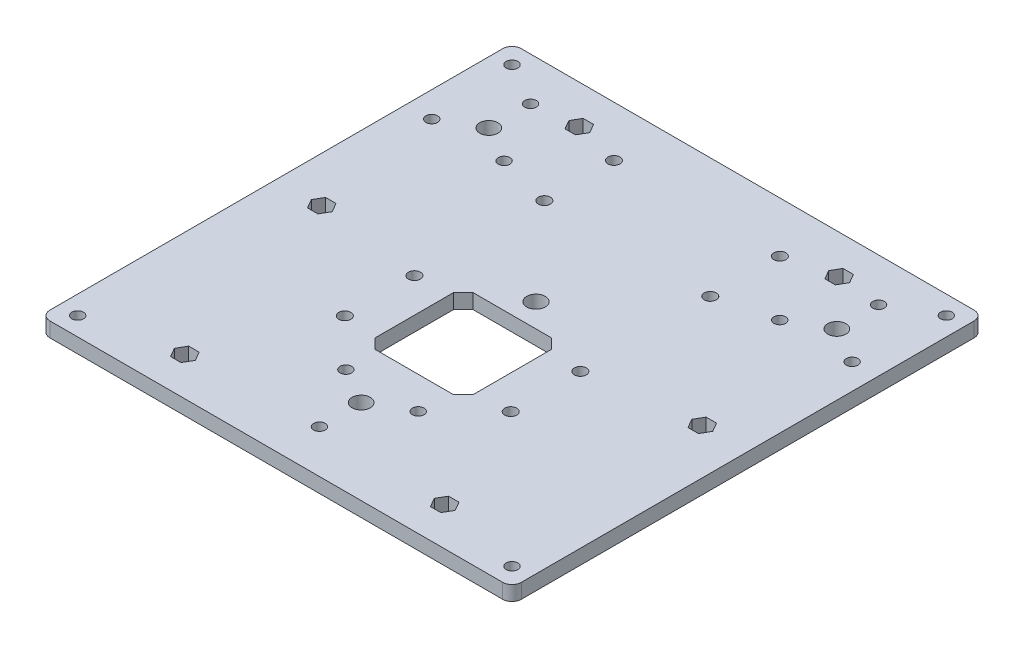
from build123d import *

# Parameters (mm, degrees)
ESQUISSE1_W                = 203.2
ESQUISSE1_H                = 203.2
BOSS_EXTRU_1_DEPTH         = 6.35
ESQUISSE2_R                = 3.925
ENL_V_MAT_EXTRU_1_DEPTH    = 144.824345992
ESQUISSE5_R                = 2.6
ENL_V_MAT_EXTRU_4_DEPTH    = 144.824345992
ESQUISSE6_R                = 2.5
ENL_V_MAT_EXTRU_5_DEPTH    = 144.824345992
ESQUISSE7_R                = 2.5
ENL_V_MAT_EXTRU_6_DEPTH    = 144.824345992
ESQUISSE8_R                = 4
ENL_V_MAT_EXTRU_7_DEPTH    = 144.824345992
ESQUISSE9_R                = 2.5
ENL_V_MAT_EXTRU_8_DEPTH    = 144.824345992
SYM_TRIE2_COPY_1_SKETCH_R  = 2.5
SYM_TRIE2_COPY_1_DEPTH     = 144.824345992
ENL_V_MAT_EXTRU_9_DEPTH    = 144.824345992
CONG_1_R                   = 4
ENL_V_MAT_EXTRU_10_DEPTH   = 144.824345992
R_P_TITION_LIN_AIRE3_COUNT = 2
R_P_TITION_LIN_AIRE3_PITCH = 86


with BuildPart() as part:
    # Esquisse1 → Boss.-Extru.1 (new body)
    with BuildSketch(Plane(origin=(0, 0, 0), x_dir=(1, 0, 0), z_dir=(0, 1, 0))):
        Rectangle(ESQUISSE1_W, ESQUISSE1_H)
    extrude(amount=BOSS_EXTRU_1_DEPTH)

    # Esquisse2 → Enlèv. mat.-Extru.1 (cut, through all)
    with BuildSketch(Plane(origin=(0, 6.35, 0), x_dir=(1, 0, 0), z_dir=(0, 1, 0))):
        with Locations(Location((-75, 65, 0), (0, 0, 270))):
            Circle(ESQUISSE2_R)
        with Locations(Location((75, 65, 0), (0, 0, 270))):
            Circle(ESQUISSE2_R)
        with Locations(Location((0, -65, 0), (0, 0, 270))):
            Circle(ESQUISSE2_R)
    extrude(amount=-ENL_V_MAT_EXTRU_1_DEPTH, mode=Mode.SUBTRACT)

    # Esquisse5 → Enlèv. mat.-Extru.4 (cut, through all)
    with BuildSketch(Plane(origin=(0, 6.35, 0), x_dir=(1, 0, 0), z_dir=(0, 1, 0))):
        with Locations(Location((-35.9, 49.85, 0), (0, 0, 270))):
            Circle(ESQUISSE5_R)
        with Locations(Location((-35.9, 79.85, 0), (0, 0, 270))):
            Circle(ESQUISSE5_R)
        with Locations(Location((35.6, 49.85, 0), (0, 0, 270))):
            Circle(ESQUISSE5_R)
        with Locations(Location((35.6, 79.85, 0), (0, 0, 270))):
            Circle(ESQUISSE5_R)
    enl_v_mat_extru_4 = extrude(amount=-ENL_V_MAT_EXTRU_4_DEPTH, mode=Mode.SUBTRACT)

    # Esquisse6 → Enlèv. mat.-Extru.5 (cut, through all)
    with BuildSketch(Plane(origin=(0, 6.35, 0), x_dir=(1, 0, 0), z_dir=(0, 1, 0))):
        with Locations(Location((93.6, -93.6, 0), (0, 0, 270))):
            Circle(ESQUISSE6_R)
        with Locations(Location((-93.6, -93.6, 0), (0, 0, 270))):
            Circle(ESQUISSE6_R)
        with Locations(Location((-93.6, 93.6, 0), (0, 0, 270))):
            Circle(ESQUISSE6_R)
        with Locations(Location((93.6, 93.6, 0), (0, 0, 270))):
            Circle(ESQUISSE6_R)
    extrude(amount=-ENL_V_MAT_EXTRU_5_DEPTH, mode=Mode.SUBTRACT)

    # Esquisse7 → Enlèv. mat.-Extru.6 (cut, through all)
    with BuildSketch(Plane(origin=(0, 6.35, 0), x_dir=(1, 0, 0), z_dir=(0, 1, 0))):
        with Locations(Location((15.588457268, -56, 0), (0, 0, 270))):
            Circle(ESQUISSE7_R)
        with Locations(Location((-15.588457268, -56, 0), (0, 0, 270))):
            Circle(ESQUISSE7_R)
        with Locations(Location((0, -83, 0), (0, 0, 270))):
            Circle(ESQUISSE7_R)
        with Locations(Location((90.588457268, 56, 0), (0, 0, 270))):
            Circle(ESQUISSE7_R)
        with Locations(Location((59.411542732, 56, 0), (0, 0, 270))):
            Circle(ESQUISSE7_R)
        with Locations(Location((75, 83, 0), (0, 0, 270))):
            Circle(ESQUISSE7_R)
        with Locations(Location((-90.589923123, 55.999154304, 0), (0, 0, 270))):
            Circle(ESQUISSE7_R)
        with Locations(Location((-59.413008586, 55.999154304, 0), (0, 0, 270))):
            Circle(ESQUISSE7_R)
        with Locations(Location((-75.001465855, 82.999154304, 0), (0, 0, 270))):
            Circle(ESQUISSE7_R)
    extrude(amount=-ENL_V_MAT_EXTRU_6_DEPTH, mode=Mode.SUBTRACT)

    # Esquisse8 → Enlèv. mat.-Extru.7 (cut, through all)
    with BuildSketch(Plane(origin=(0, 6.35, 0), x_dir=(1, 0, 0), z_dir=(0, 1, 0))):
        with Locations(Location((0, 10.325, 0), (0, 0, 270))):
            Circle(ESQUISSE8_R)
    extrude(amount=-ENL_V_MAT_EXTRU_7_DEPTH, mode=Mode.SUBTRACT)

    # Esquisse9 → Enlèv. mat.-Extru.8 (cut, through all)
    with BuildSketch(Plane.XZ):
        with Locations(Location((56, -85, 0), (0, 0, 270))):
            Circle(ESQUISSE9_R)
        with Locations(Location((82, 0, 0), (0, 0, 270))):
            Circle(ESQUISSE9_R)
    enl_v_mat_extru_8 = extrude(amount=-ENL_V_MAT_EXTRU_8_DEPTH, mode=Mode.SUBTRACT)

    # Symétrie1: Enlèv. mat.-Extru.8 across plane
    add(enl_v_mat_extru_8.mirror(Plane.XY), mode=Mode.SUBTRACT)

    # Symétrie2: Enlèv. mat.-Extru.8 across plane
    add(enl_v_mat_extru_8.mirror(Plane(origin=(0, 0, 0), x_dir=(0, 0, 1), z_dir=(1, 0, 0))), mode=Mode.SUBTRACT)

    # Symétrie2 copy 1 sketch → Symétrie2 copy 1 (cut, through all)
    with BuildSketch(Plane(origin=(0, 0, 0), x_dir=(-1, 0, 0), z_dir=(0, -1, 0))):
        with Locations(Location((56, -85, 0), (0, 0, 270))):
            Circle(SYM_TRIE2_COPY_1_SKETCH_R)
        with Locations(Location((82, 0, 0), (0, 0, 270))):
            Circle(SYM_TRIE2_COPY_1_SKETCH_R)
    extrude(amount=-SYM_TRIE2_COPY_1_DEPTH, mode=Mode.SUBTRACT)

    # Esquisse11 → Enlèv. mat.-Extru.9 (cut, through all)
    with BuildSketch(Plane.XZ):
        Polygon((-60.5033321, -85), (-58.25166605, -88.9), (-53.74833395, -88.9), (-51.4966679, -85), (-53.74833395, -81.1), (-58.25166605, -81.1), align=None)
        Polygon((-86.5033321, 0), (-84.25166605, -3.9), (-79.74833395, -3.9), (-77.4966679, 0), (-79.74833395, 3.9), (-84.25166605, 3.9), align=None)
        Polygon((-60.5033321, 85), (-58.25166605, 81.1), (-53.74833395, 81.1), (-51.4966679, 85), (-53.74833395, 88.9), (-58.25166605, 88.9), align=None)
        Polygon((51.4966679, 85), (53.74833395, 81.1), (58.25166605, 81.1), (60.5033321, 85), (58.25166605, 88.9), (53.74833395, 88.9), align=None)
        Polygon((77.4966679, 0), (79.74833395, -3.9), (84.25166605, -3.9), (86.5033321, 0), (84.25166605, 3.9), (79.74833395, 3.9), align=None)
        Polygon((60.5033321, -85), (58.25166605, -81.1), (53.74833395, -81.1), (51.4966679, -85), (53.74833395, -88.9), (58.25166605, -88.9), align=None)
    extrude(amount=-ENL_V_MAT_EXTRU_9_DEPTH, mode=Mode.SUBTRACT)

    # Congé1
    cong_1_edges = [part.edges().sort_by_distance(p)[0] for p in [
        (101.6, 3.175, 101.6),
        (-101.6, 3.175, 101.6),
        (-101.6, 3.175, -101.6),
        (101.6, 3.175, -101.6),
    ]]
    fillet(cong_1_edges, radius=CONG_1_R)

    # Esquisse13 → Enlèv. mat.-Extru.10 (cut, through all)
    with BuildSketch(Plane(origin=(0, 6.35, 0), x_dir=(1, 0, 0), z_dir=(0, 1, 0))):
        Polygon((-16.978069991, 0.149999997), (16.978069991, 0.149999997), (21.15, -4.021930012), (21.15, -37.978069994), (16.978069991, -42.150000003), (-16.978069991, -42.150000003), (-21.15, -37.978069994), (-21.15, -4.021930012), align=None)
    extrude(amount=-ENL_V_MAT_EXTRU_10_DEPTH, mode=Mode.SUBTRACT)

    # Répétition linéaire3: Enlèv. mat.-Extru.4 ×2
    with Locations(*[(0, 0, i * R_P_TITION_LIN_AIRE3_PITCH) for i in range(1, R_P_TITION_LIN_AIRE3_COUNT)]):
        add(enl_v_mat_extru_4, mode=Mode.SUBTRACT)


solid = part.part
